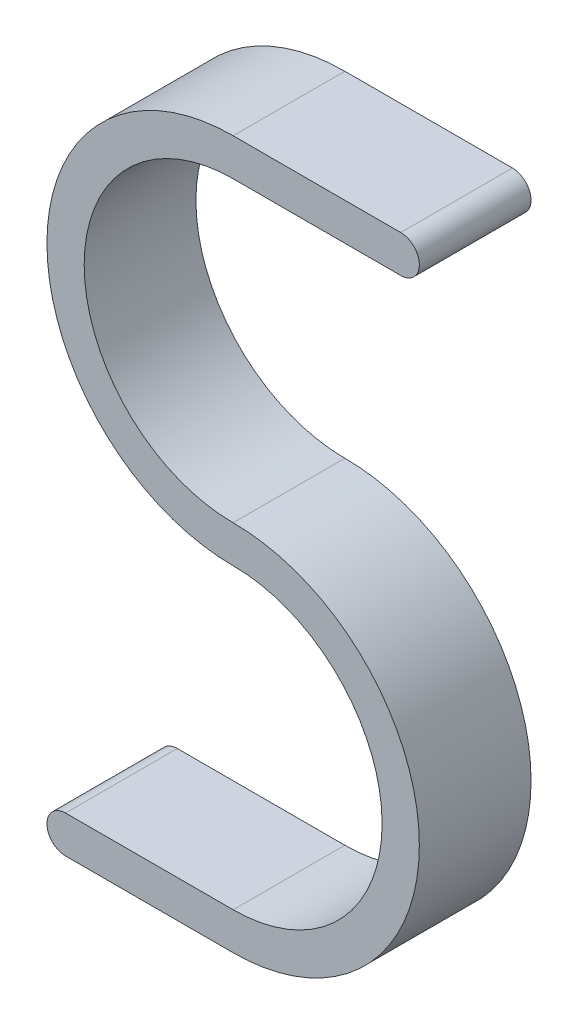
from build123d import *

# Parameters (mm, degrees)
BOSS_EXTRUDE1_DEPTH = 15


with BuildPart() as part:
    # Sketch2 → Boss-Extrude1 (new body)
    with BuildSketch(Plane.XY):
        with BuildLine():
            Line((0, -40), (-22.5, -40))
            ThreePointArc((-22.5, -40), (-25, -42.5), (-22.5, -45))
            Line((-22.5, -45), (0, -45))
            ThreePointArc((0, -45), (25, -20), (0, 5))
            ThreePointArc((0, 5), (-20, 25), (0, 45))
            Line((0, 45), (22.5, 45))
            ThreePointArc((22.5, 45), (25, 47.5), (22.5, 50))
            Line((22.5, 50), (0, 50))
            ThreePointArc((0, 50), (-25, 25), (0, 0))
            ThreePointArc((0, 0), (20, -20), (0, -40))
        make_face()
    extrude(amount=BOSS_EXTRUDE1_DEPTH)


solid = part.part
